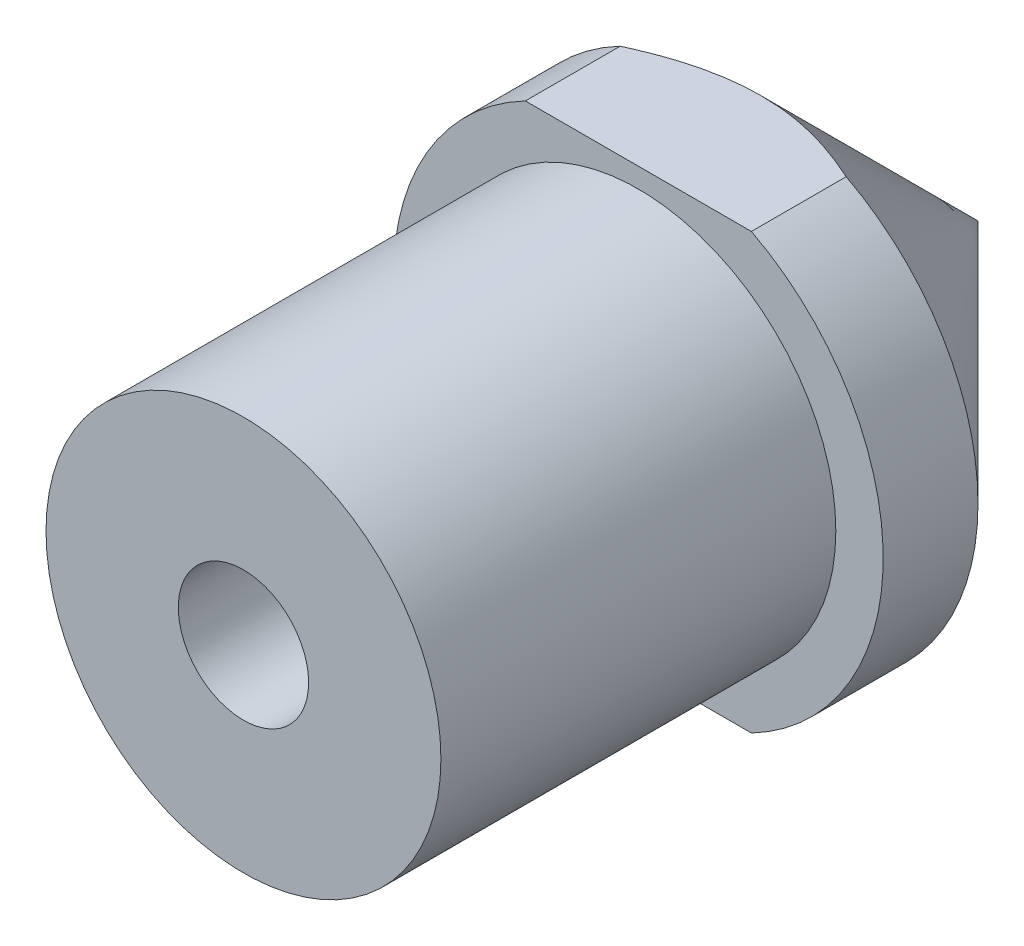
from build123d import *

# Parameters (mm, degrees)
SKETCH1_R                 = 5
BOSS_EXTRUDE1_DEPTH       = 10
BOSS_EXTRUDE3_DEPTH       = 2.4
SKETCH15_W                = 6.028380363
SKETCH15_H                = 2.991132054
CUT_EXTRUDE1_DEPTH        = 2.4
SKETCH16_W                = 6.590795167
SKETCH16_H                = 1.091372194
CUT_EXTRUDE3_DEPTH        = 2.4
M4X0_7_TAPPED_HOLE1_D     = 3.3
M4X0_7_TAPPED_HOLE1_DEPTH = 10.1
M4X0_7_TAPPED_HOLE1_TIP   = 0.991420021


with BuildPart() as part:
    # Sketch1 → Boss-Extrude1 (new body)
    with BuildSketch(Plane.XY):
        with Locations((-22.664426825, -3.702604382)):
            Circle(SKETCH1_R)
    extrude(amount=BOSS_EXTRUDE1_DEPTH)

    # Sketch2 → Boss-Extrude3 (add)
    with BuildSketch(Plane(origin=(0, 0, 0), x_dir=(-1, 0, 0), z_dir=(0, 0, -1))):
        with BuildLine():
            Line((25.526244429, -9.202604382), (19.80260922, -9.202604382))
            ThreePointArc((19.80260922, -9.202604382), (16.464426825, -3.702604382), (19.80260922, 1.797395618))
            Line((19.80260922, 1.797395618), (25.526244429, 1.797395618))
            ThreePointArc((25.526244429, 1.797395618), (28.864426825, -3.702604382), (25.526244429, -9.202604382))
        make_face()
    extrude(amount=BOSS_EXTRUDE3_DEPTH)

    # Sketch13 → Revolve1 (revolve)
    with BuildSketch(Plane(origin=(0, -3.702604382, 0), x_dir=(1, 0, 0), z_dir=(0, 1, 0)), mode=Mode.PRIVATE) as revolve1_sk:
        Polygon((-16.464426825, 2.4), (-22.664426825, 2.4), (-22.664426825, 8.6), align=None)
    revolve(revolve1_sk.sketch.rotate(Axis((-22.664426825, -3.702604382, -2.4), (0, 0, -1)), 180), axis=Axis((-22.664426825, -3.702604382, -2.4), (0, 0, -1)))

    # Sketch15 → Cut-Extrude1 (cut)
    with BuildSketch(Plane.XY.offset(-2.4)):
        with Locations((-22.512054248, 3.292961645)):
            Rectangle(SKETCH15_W, SKETCH15_H)
    extrude(amount=-CUT_EXTRUDE1_DEPTH, mode=Mode.SUBTRACT)

    # Sketch16 → Cut-Extrude3 (cut)
    with BuildSketch(Plane.XY.offset(-2.4)):
        with Locations((-23.098006803, -9.748290479)):
            Rectangle(SKETCH16_W, SKETCH16_H)
    extrude(amount=-CUT_EXTRUDE3_DEPTH, mode=Mode.SUBTRACT)

    # M4x0.7 Tapped Hole1
    with Locations(Plane.XY.offset(10)):
        with Locations((-22.664426825, -3.702604382)):
            Hole(M4X0_7_TAPPED_HOLE1_D / 2, depth=M4X0_7_TAPPED_HOLE1_DEPTH)
            with Locations((0, 0, -(M4X0_7_TAPPED_HOLE1_DEPTH + M4X0_7_TAPPED_HOLE1_TIP / 2))):  # 118° drill point
                Cone(0, M4X0_7_TAPPED_HOLE1_D / 2, M4X0_7_TAPPED_HOLE1_TIP, mode=Mode.SUBTRACT)


solid = part.part
